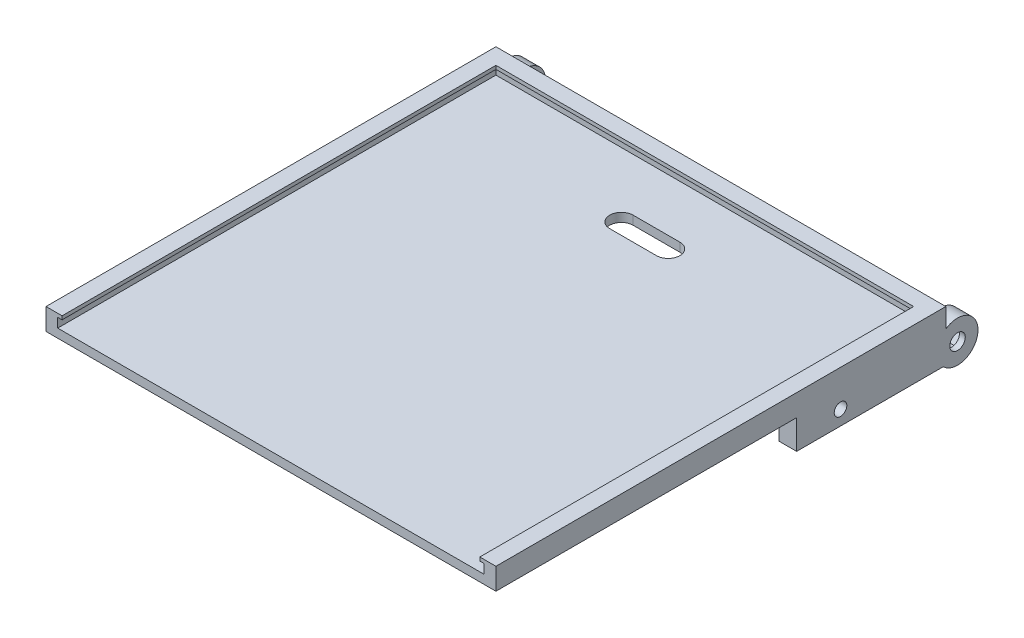
from build123d import *

# Parameters (mm, degrees)
CROQUIS_PLACA_W                      = 153.8
CROQUIS_PLACA_H                      = 153.8
PLACA_DEPTH                          = 3
CROQUIS_BORDE_IZQ_W                  = 4
CROQUIS_BORDE_IZQ_H                  = 153.8
BORDE_IZQ_DEPTH                      = 3.2
CROQUIS_BORDE_DER_W                  = 4
CROQUIS_BORDE_DER_H                  = 153.8
BORDE_DER_DEPTH                      = 3.2
CROQUIS_BORDE_TRAS_W                 = 145.8
CROQUIS_BORDE_TRAS_H                 = 4
BORDE_TRAS_DEPTH                     = 3.2
CROQUIS_CEJA_IZQ_W                   = 5.5
CROQUIS_CEJA_IZQ_H                   = 153.8
CEJA_IZQ_DEPTH                       = 1.2
CROQUIS_CEJA_DER_W                   = 5.5
CROQUIS_CEJA_DER_H                   = 153.8
CEJA_DER_DEPTH                       = 1.2
CROQUIS_CEJA_TRAS_W                  = 148.3
CROQUIS_CEJA_TRAS_H                  = 5.5
CEJA_TRAS_DEPTH                      = 1.2
PASO_CABLE_DEPTH                     = 176.977867927
PASO_CABLE_DEPTH_BACK                = 176.977867927
CROQUIS_REFUERZOS_W                  = 3
CROQUIS_REFUERZOS_H                  = 142
REFUERZOS_DEPTH                      = 5
CROQUIS_COSTILLA_DER_W               = 55
CROQUIS_COSTILLA_DER_H               = 10
COSTILLA_DER_DEPTH                   = 6
CROQUIS_BUJE_DER_R                   = 7
BUJE_DER_DEPTH                       = 6
CROQUIS_COSTILLA_IZQ_W               = 55
CROQUIS_COSTILLA_IZQ_H               = 10
COSTILLA_IZQ_DEPTH                   = 6
BUJE_IZQ_START                       = -6
CROQUIS_BUJE_IZQ_R                   = 7
BUJE_IZQ_DEPTH                       = 6
AGUJEROS_PIVOTE_Y_BLOQUEO_DEPTH      = 176.977867927
AGUJEROS_PIVOTE_Y_BLOQUEO_DEPTH_BACK = 176.977867927
CROQUIS_AGUJEROS_EJE_R               = 2.65
CROQUIS_AGUJEROS_EJE_R_2             = 2.15
TUERCA_M5_DER_DEPTH                  = 4
TUERCAS_M5_M4_IZQ_DEPTH              = 4


with BuildPart() as part:
    # Croquis_placa → Placa (new body)
    with BuildSketch(Plane(origin=(0, 5, 0), x_dir=(1, 0, 0), z_dir=(0, 1, 0))):
        with Locations((0, -80.9)):
            Rectangle(CROQUIS_PLACA_W, CROQUIS_PLACA_H)
    extrude(amount=PLACA_DEPTH)

    # Croquis_Borde_izq → Borde_izq (add)
    with BuildSketch(Plane(origin=(0, 8, 0), x_dir=(1, 0, 0), z_dir=(0, 1, 0))):
        with Locations((-74.9, -80.9)):
            Rectangle(CROQUIS_BORDE_IZQ_W, CROQUIS_BORDE_IZQ_H)
    extrude(amount=BORDE_IZQ_DEPTH)

    # Croquis_Borde_der → Borde_der (add)
    with BuildSketch(Plane(origin=(0, 8, 0), x_dir=(1, 0, 0), z_dir=(0, 1, 0))):
        with Locations((74.9, -80.9)):
            Rectangle(CROQUIS_BORDE_DER_W, CROQUIS_BORDE_DER_H)
    extrude(amount=BORDE_DER_DEPTH)

    # Croquis_Borde_tras → Borde_tras (add)
    with BuildSketch(Plane(origin=(0, 8, 0), x_dir=(1, 0, 0), z_dir=(0, 1, 0))):
        with Locations((0, -6)):
            Rectangle(CROQUIS_BORDE_TRAS_W, CROQUIS_BORDE_TRAS_H)
    extrude(amount=BORDE_TRAS_DEPTH)

    # Croquis_Ceja_izq → Ceja_izq (add)
    with BuildSketch(Plane(origin=(0, 11.2, 0), x_dir=(1, 0, 0), z_dir=(0, 1, 0))):
        with Locations((-74.15, -80.9)):
            Rectangle(CROQUIS_CEJA_IZQ_W, CROQUIS_CEJA_IZQ_H)
    extrude(amount=CEJA_IZQ_DEPTH)

    # Croquis_Ceja_der → Ceja_der (add)
    with BuildSketch(Plane(origin=(0, 11.2, 0), x_dir=(1, 0, 0), z_dir=(0, 1, 0))):
        with Locations((74.15, -80.9)):
            Rectangle(CROQUIS_CEJA_DER_W, CROQUIS_CEJA_DER_H)
    extrude(amount=CEJA_DER_DEPTH)

    # Croquis_Ceja_tras → Ceja_tras (add)
    with BuildSketch(Plane(origin=(0, 11.2, 0), x_dir=(1, 0, 0), z_dir=(0, 1, 0))):
        with Locations((0, -6.75)):
            Rectangle(CROQUIS_CEJA_TRAS_W, CROQUIS_CEJA_TRAS_H)
    extrude(amount=CEJA_TRAS_DEPTH)

    # Croquis_cable → Paso_cable (cut, two sides: drawn at the far end of the back side and taken through both)
    with BuildSketch(Plane(origin=(0, 0, 0), x_dir=(1, 0, 0), z_dir=(0, 1, 0)).offset(-PASO_CABLE_DEPTH_BACK)):
        with BuildLine():
            Line((-8, -26), (8, -26))
            ThreePointArc((8, -26), (12, -30), (8, -34))
            Line((8, -34), (-8, -34))
            ThreePointArc((-8, -34), (-12, -30), (-8, -26))
        make_face()
    extrude(amount=PASO_CABLE_DEPTH + PASO_CABLE_DEPTH_BACK, mode=Mode.SUBTRACT)

    # Croquis_refuerzos → Refuerzos (add)
    with BuildSketch(Plane(origin=(0, 5, 0), x_dir=(1, 0, 0), z_dir=(0, 1, 0))):
        with Locations((-40, -79)):
            Rectangle(CROQUIS_REFUERZOS_W, CROQUIS_REFUERZOS_H)
        with Locations((40, -79)):
            Rectangle(CROQUIS_REFUERZOS_W, CROQUIS_REFUERZOS_H)
    extrude(amount=-REFUERZOS_DEPTH)

    # Croquis_costilla_der → Costilla_der (add)
    with BuildSketch(Plane(origin=(70.9, 0, 0), x_dir=(0, 0, -1), z_dir=(1, 0, 0))):
        with Locations((-27.5, 0)):
            Rectangle(CROQUIS_COSTILLA_DER_W, CROQUIS_COSTILLA_DER_H)
    extrude(amount=COSTILLA_DER_DEPTH)

    # Croquis_buje_der → Buje_der (add)
    with BuildSketch(Plane(origin=(70.9, 0, 0), x_dir=(0, 0, -1), z_dir=(1, 0, 0))):
        Circle(CROQUIS_BUJE_DER_R)
    extrude(amount=BUJE_DER_DEPTH)

    # Croquis_costilla_izq → Costilla_izq (add)
    with BuildSketch(Plane(origin=(-70.9, 0, 0), x_dir=(0, 0, -1), z_dir=(1, 0, 0))):
        with Locations((-27.5, 0)):
            Rectangle(CROQUIS_COSTILLA_IZQ_W, CROQUIS_COSTILLA_IZQ_H)
    extrude(amount=-COSTILLA_IZQ_DEPTH)

    # Croquis_buje_izq → Buje_izq (add)
    with BuildSketch(Plane(origin=(-70.9, 0, 0), x_dir=(0, 0, -1), z_dir=(1, 0, 0)).offset(BUJE_IZQ_START)):
        Circle(CROQUIS_BUJE_IZQ_R)
    extrude(amount=BUJE_IZQ_DEPTH)

    # Croquis_agujeros_eje → Agujeros_pivote_y_bloqueo (cut, two sides: drawn at the far end of the back side and taken through both)
    with BuildSketch(Plane(origin=(0, 0, 0), x_dir=(0, 0, -1), z_dir=(1, 0, 0)).offset(-AGUJEROS_PIVOTE_Y_BLOQUEO_DEPTH_BACK)):
        with Locations(Location((0, 0, 0), (0, 0, 180))):
            Circle(CROQUIS_AGUJEROS_EJE_R)
        with Locations(Location((-40, 0, 0), (0, 0, 180))):
            Circle(CROQUIS_AGUJEROS_EJE_R_2)
    extrude(amount=AGUJEROS_PIVOTE_Y_BLOQUEO_DEPTH + AGUJEROS_PIVOTE_Y_BLOQUEO_DEPTH_BACK, mode=Mode.SUBTRACT)

    # Croquis_tuerca_M5_der → Tuerca_M5_der (cut)
    with BuildSketch(Plane(origin=(70.9, 0, 0), x_dir=(0, 0, -1), z_dir=(1, 0, 0))):
        Polygon((4.734272207, 0), (2.367136104, 4.1), (-2.367136104, 4.1), (-4.734272207, 0), (-2.367136104, -4.1), (2.367136104, -4.1), align=None)
    extrude(amount=TUERCA_M5_DER_DEPTH, mode=Mode.SUBTRACT)

    # Croquis_tuercas_izq → Tuercas_M5_M4_izq (cut)
    with BuildSketch(Plane(origin=(-70.9, 0, 0), x_dir=(0, 0, -1), z_dir=(1, 0, 0))):
        Polygon((4.734272207, 0), (2.367136104, 4.1), (-2.367136104, 4.1), (-4.734272207, 0), (-2.367136104, -4.1), (2.367136104, -4.1), align=None)
        Polygon((-35.843078062, 0), (-37.921539031, 3.6), (-42.078460969, 3.6), (-44.156921938, 0), (-42.078460969, -3.6), (-37.921539031, -3.6), align=None)
    extrude(amount=-TUERCAS_M5_M4_IZQ_DEPTH, mode=Mode.SUBTRACT)


solid = part.part
